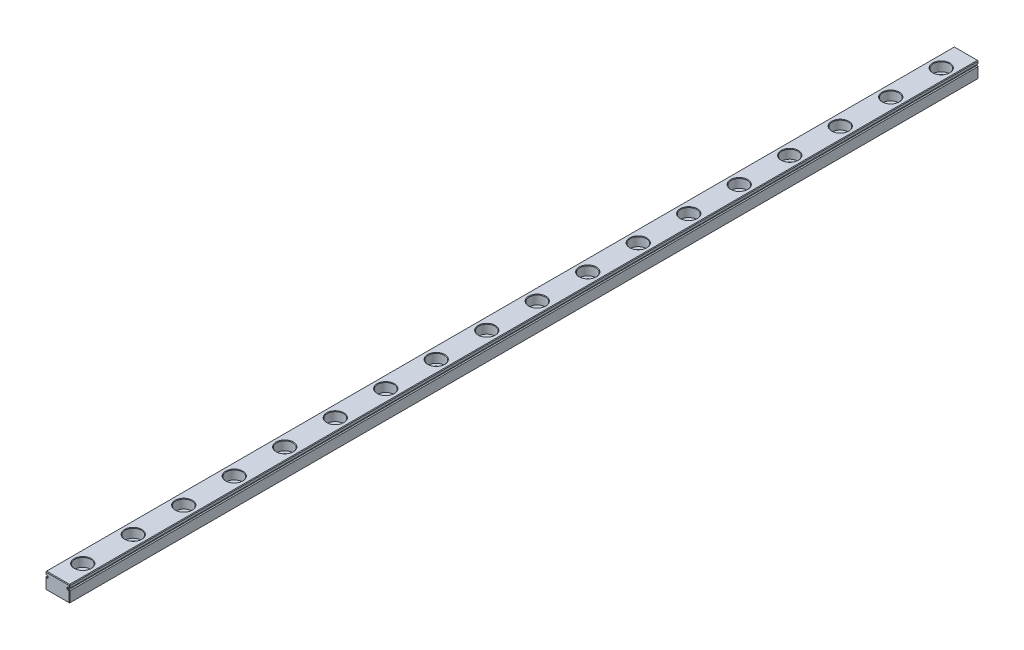
from build123d import *

# Parameters (mm, degrees)
BOSS_EXTRUDE1_DEPTH = 450
CHAMFER1_SIZE       = 0.3
LPATTERN1_COUNT     = 18
LPATTERN1_PITCH     = 25


with BuildPart() as part:
    # Sketch1 → Boss-Extrude1 (new body)
    with BuildSketch(Plane.XY):
        with BuildLine():
            Line((0, 8), (12, 8))
            Line((12, 8), (12, 6.75))
            Line((12, 6.75), (12, 6.559016994))
            ThreePointArc((12, 6.559016994), (11.706107374, 6.475528258), (11.5, 6.25))
            Line((11.5, 6.25), (11, 6.25))
            Line((11, 6.25), (11, 5.75))
            Line((11, 5.75), (11.5, 5.75))
            ThreePointArc((11.5, 5.75), (11.706107374, 5.524471742), (12, 5.440983006))
            Line((12, 5.440983006), (12, 5.25))
            Line((12, 5.25), (12, 0))
            Line((12, 0), (0, 0))
            Line((0, 0), (0, 5.25))
            Line((0, 5.25), (0, 5.440983006))
            ThreePointArc((0, 5.440983006), (0.293892626, 5.524471742), (0.5, 5.75))
            Line((0.5, 5.75), (1, 5.75))
            Line((1, 5.75), (1, 6.25))
            Line((1, 6.25), (0.5, 6.25))
            ThreePointArc((0.5, 6.25), (0.293892626, 6.475528258), (0, 6.559016994))
            Line((0, 6.559016994), (0, 6.75))
            Line((0, 6.75), (0, 8))
        make_face()
    extrude(amount=BOSS_EXTRUDE1_DEPTH)

    # Chamfer1
    chamfer1_edges = [part.edges().sort_by_distance(p)[0] for p in [
        (12, 2.720491503, 450),
        (11.706107374, 5.524471742, 450),
        (0, 2.720491503, 0),
        (0.293892626, 5.524471742, 0),
        (0.75, 5.75, 0),
        (1, 6, 0),
        (0.75, 6.25, 0),
        (11.25, 5.75, 450),
        (0.293892626, 6.475528258, 0),
        (0, 7.279508497, 0),
        (6, 8, 0),
        (12, 7.279508497, 0),
        (11.706107374, 6.475528258, 0),
        (11, 6, 450),
        (11.25, 6.25, 0),
        (11, 6, 0),
        (11.25, 5.75, 0),
        (11.706107374, 5.524471742, 0),
        (12, 2.720491503, 0),
        (6, 0, 0),
        (11.25, 6.25, 450),
        (11.706107374, 6.475528258, 450),
        (12, 7.279508497, 450),
        (0, 8, 225),
        (12, 8, 225),
        (12, 0, 225),
        (0, 0, 225),
        (6, 8, 450),
        (0, 2.720491503, 450),
        (0, 7.279508497, 450),
        (0.293892626, 6.475528258, 450),
        (0.75, 6.25, 450),
        (1, 6, 450),
        (0.75, 5.75, 450),
        (0.293892626, 5.524471742, 450),
        (6, 0, 450),
    ]]
    chamfer(chamfer1_edges, length=CHAMFER1_SIZE)

    # Sketch3 → CBORE for M5 Hex Head Bolt1 (revolve, cut)
    with BuildSketch(Plane(origin=(6, 8, 12.5), x_dir=(0, 0, 1), z_dir=(1, 0, 0))):
        Polygon((0, 0), (0, 8), (2.5, 8), (2.25, 7.75), (2.25, 4.5), (4, 4.5), (4, 0.25), (4.25, 0), align=None)
    cbore_for_m5_hex_head_bolt1 = revolve(axis=Axis((6, 14.35, 12.5), (0, -1, 0)), mode=Mode.SUBTRACT)

    # LPattern1: CBORE for M5 Hex Head Bolt1 ×18
    with Locations(*[(0, 0, i * LPATTERN1_PITCH) for i in range(1, LPATTERN1_COUNT)]):
        add(cbore_for_m5_hex_head_bolt1, mode=Mode.SUBTRACT)


solid = part.part
